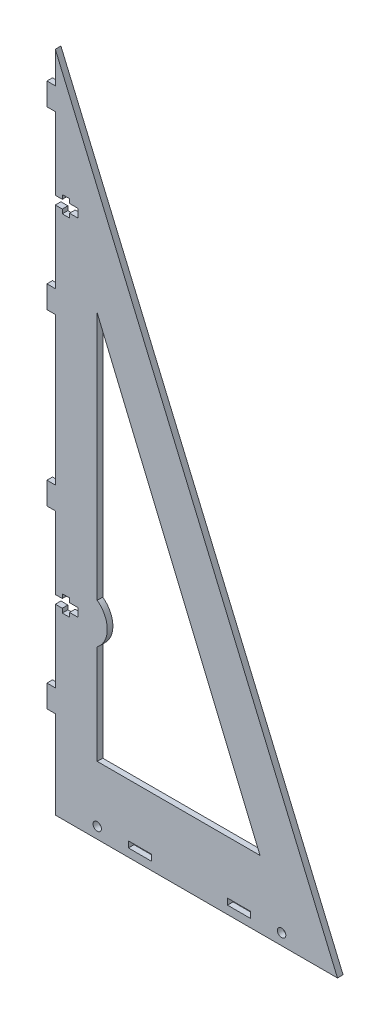
from build123d import *

# Parameters (mm, degrees)
SKETCH_1_R      = 1.5
SKETCH_1_W      = 8.2
SKETCH_1_H      = 2.2
EXTRUDE_1_DEPTH = 2


with BuildPart() as part:
    # 草图1 → 凸台-拉伸1 (new body)
    with BuildSketch(Plane.XY):
        Polygon((-45.72603831, 61.027402263), (-45.72603831, 59.527402263), (-43.12603831, 59.527402263), (-43.12603831, 61.027402263), (-40.12603831, 61.027402263), (-40.12603831, 64.027402263), (-43.12603831, 64.027402263), (-43.12603831, 65.527402263), (-45.72603831, 65.527402263), (-45.72603831, 64.027402263), (-48.22603831, 64.027402263), (-48.22603831, 89.964902263), (-51.22603831, 89.964902263), (-51.22603831, 97.964902263), (-48.22603831, 97.964902263), (-48.22603831, 150.839902263), (-51.22603831, 150.839902263), (-51.22603831, 158.839902263), (-48.22603831, 158.839902263), (-48.22603831, 184.777402263), (-45.72603831, 184.777402263), (-45.72603831, 183.277402263), (-43.12603831, 183.277402263), (-43.12603831, 184.777402263), (-40.12603831, 184.777402263), (-40.12603831, 187.777402263), (-43.12603831, 187.777402263), (-43.12603831, 189.277402263), (-45.72603831, 189.277402263), (-45.72603831, 187.777402263), (-48.22603831, 187.777402263), (-48.22603831, 213.714902263), (-51.22603831, 213.714902263), (-51.22603831, 221.714902263), (-48.22603831, 221.714902263), (-48.22603831, 233.059504861), (52.77396169, -4.347597737), (19.52396169, -4.347597737), (-17.97603831, -4.347597737), (-48.22603831, -4.347597737), (-48.22603831, 27.089902263), (-51.22603831, 27.089902263), (-51.22603831, 35.089902263), (-48.22603831, 35.089902263), (-48.22603831, 61.027402263), align=None)
        with Locations((-33.22603831, -0.347597737)):
            Circle(SKETCH_1_R, mode=Mode.SUBTRACT)
        with Locations((32.77396169, -0.347597737)):
            Circle(SKETCH_1_R, mode=Mode.SUBTRACT)
        with Locations((-17.97603831, -0.347597737)):
            Rectangle(SKETCH_1_W, SKETCH_1_H, mode=Mode.SUBTRACT)
        with Locations((17.52396169, -0.347597737)):
            Rectangle(SKETCH_1_W, SKETCH_1_H, mode=Mode.SUBTRACT)
        with BuildLine():
            Line((-33.22603831, 158.839902263), (25.051240135, 19.790255804))
            Line((25.051240135, 19.790255804), (-29.798759865, 19.790255804))
            Line((-29.798759865, 19.790255804), (-33.22603831, 19.790255804))
            Line((-33.22603831, 19.790255804), (-33.22603831, 27.089902263))
            Line((-33.22603831, 27.089902263), (-33.22603831, 55.327402263))
            ThreePointArc((-33.22603831, 55.327402263), (-29.62603831, 62.527402263), (-33.22603831, 69.727402263))
            Line((-33.22603831, 69.727402263), (-33.22603831, 158.839902263))
        make_face(mode=Mode.SUBTRACT)
    extrude(amount=EXTRUDE_1_DEPTH)


solid = part.part
